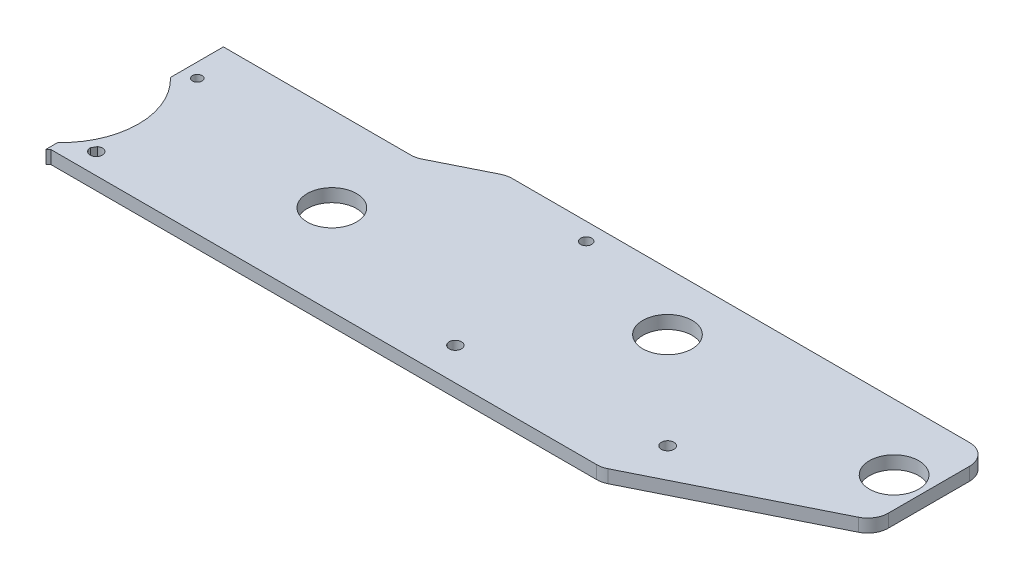
from build123d import *

# Parameters (mm, degrees)
SKETCH1_W           = 210
SKETCH1_H           = 50
SKETCH1_R           = 1.211665018
SKETCH1_R_2         = 1.165617118
SKETCH1_R_3         = 1.5
SKETCH1_R_4         = 1.517273905
SKETCH1_R_5         = 1.335614121
SKETCH1_R_6         = 1.62438417
BOSS_EXTRUDE1_DEPTH = 3.175
SKETCH2_R           = 2
CUT_EXTRUDE1_DEPTH  = 10
SKETCH3_R           = 6
SKETCH3_R_2         = 0.586995366
CUT_EXTRUDE2_DEPTH  = 57.15
CUT_EXTRUDE7_DEPTH  = 10
FILLET3_R           = 5
SKETCH11_R          = 18.5
SKETCH11_R_2        = 2
BOSS_EXTRUDE4_DEPTH = 3.175
SKETCH12_R          = 21
BOSS_EXTRUDE5_DEPTH = 3.175
SKETCH13_R          = 18.85
CUT_EXTRUDE8_DEPTH  = 3.175
BOSS_EXTRUDE6_DEPTH = 3.175
FILLET4_R           = 5
SKETCH15_R          = 1.5
CUT_EXTRUDE9_DEPTH  = 10
SKETCH16_R          = 1.5
CUT_EXTRUDE10_DEPTH = 10
SKETCH17_W          = 82.811100577
SKETCH17_H          = 66.522656387
CUT_EXTRUDE11_DEPTH = 10


with BuildPart() as part:
    # Sketch1 → Boss-Extrude1 (new body)
    with BuildSketch(Plane(origin=(0, 0, 0), x_dir=(1, 0, 0), z_dir=(0, 1, 0))):
        with Locations((105, -25)):
            Rectangle(SKETCH1_W, SKETCH1_H)
        with Locations(Location((3.489526233, -16.787661112, 0), (0, 0, 270))):
            Circle(SKETCH1_R, mode=Mode.SUBTRACT)
        with Locations(Location((34.37258772, -17.194005245, 0), (0, 0, 270))):
            Circle(SKETCH1_R_2, mode=Mode.SUBTRACT)
        with Locations(Location((37.520749958, -44.921198121, 0), (0, 0, 270))):
            Circle(SKETCH1_R_3, mode=Mode.SUBTRACT)
        with Locations(Location((168.975233936, -37.403209633, 0), (0, 0, 270))):
            Circle(SKETCH1_R_4, mode=Mode.SUBTRACT)
        with Locations(Location((116, -4.237214774, 0), (0, 0, 270))):
            Circle(SKETCH1_R_5, mode=Mode.SUBTRACT)
        with Locations(Location((12.257640281, -3.274812063, 0), (0, 0, 270))):
            Circle(SKETCH1_R_6, mode=Mode.SUBTRACT)
    extrude(amount=BOSS_EXTRUDE1_DEPTH)

    # Sketch2 → Cut-Extrude1 (cut)
    with BuildSketch(Plane(origin=(0, 3.175, 0), x_dir=(1, 0, 0), z_dir=(0, 1, 0))):
        with Locations(Location((10, -26, 0), (0, 0, 270))):
            Circle(SKETCH2_R)
        with Locations(Location((10, -42, 0), (0, 0, 270))):
            Circle(SKETCH2_R)
        with Locations(Location((26, -26, 0), (0, 0, 270))):
            Circle(SKETCH2_R)
        with Locations(Location((26, -42, 0), (0, 0, 270))):
            Circle(SKETCH2_R)
    extrude(amount=-CUT_EXTRUDE1_DEPTH, mode=Mode.SUBTRACT)

    # Sketch3 → Cut-Extrude2 (cut)
    with BuildSketch(Plane(origin=(0, 3.175, 0), x_dir=(1, 0, 0), z_dir=(0, 1, 0))):
        with Locations(Location((78.01026379, -28.1, 0), (0, 0, 270))):
            Circle(SKETCH3_R)
        with Locations(Location((145.531297368, -14, 0), (0, 0, 270))):
            Circle(SKETCH3_R)
        with Locations(Location((18, -34, 0), (0, 0, 270))):
            Circle(SKETCH3_R_2)
        with Locations(Location((202.646291021, -16, 0), (0, 0, 270))):
            Circle(SKETCH3_R)
    extrude(amount=-CUT_EXTRUDE2_DEPTH, mode=Mode.SUBTRACT)

    # Sketch10 → Cut-Extrude7 (cut)
    with BuildSketch(Plane(origin=(0, 3.175, 0), x_dir=(1, 0, 0), z_dir=(0, 1, 0))):
        Polygon((210, -27.859435908), (165.502877994, -50), (210, -50), align=None)
        Polygon((92.532613397, 0), (77.65477062, -7.402812063), (0, -7.402812063), (0, 0), align=None)
    extrude(amount=-CUT_EXTRUDE7_DEPTH, mode=Mode.SUBTRACT)

    # Fillet3
    fillet3_edges = [part.edges().sort_by_distance(p)[0] for p in [
        (210, 1.5875, 0),
        (0, 1.5875, 50),
        (92.532613397, 1.5875, 0),
        (210, 1.5875, 27.859435908),
        (165.502877994, 1.5875, 50),
        (77.65477062, 1.5875, 7.402812063),
        (0, 1.5875, 7.402812063),
    ]]
    fillet(fillet3_edges, radius=FILLET3_R)

    # Sketch11 → Boss-Extrude4 (add)
    with BuildSketch(Plane(origin=(0, 3.175, 0), x_dir=(1, 0, 0), z_dir=(0, 1, 0))):
        with Locations((18, -34)):
            Circle(SKETCH11_R)
        with Locations(Location((10, -26, 0), (0, 0, 270))):
            Circle(SKETCH11_R_2, mode=Mode.SUBTRACT)
        with Locations(Location((10, -42, 0), (0, 0, 270))):
            Circle(SKETCH11_R_2, mode=Mode.SUBTRACT)
        with Locations(Location((26, -26, 0), (0, 0, 270))):
            Circle(SKETCH11_R_2, mode=Mode.SUBTRACT)
        with Locations(Location((26, -42, 0), (0, 0, 270))):
            Circle(SKETCH11_R_2, mode=Mode.SUBTRACT)
    extrude(amount=-BOSS_EXTRUDE4_DEPTH)

    # Sketch12 → Boss-Extrude5 (add)
    with BuildSketch(Plane(origin=(0, 3.175, 0), x_dir=(1, 0, 0), z_dir=(0, 1, 0))):
        with Locations((18, -34)):
            Circle(SKETCH12_R)
    extrude(amount=-BOSS_EXTRUDE5_DEPTH)

    # Sketch13 → Cut-Extrude8 (cut)
    with BuildSketch(Plane(origin=(0, 3.175, 0), x_dir=(1, 0, 0), z_dir=(0, 1, 0))):
        with Locations(Location((18, -34, 0), (0, 0, 270))):
            Circle(SKETCH13_R)
    extrude(amount=-CUT_EXTRUDE8_DEPTH, mode=Mode.SUBTRACT)

    # Sketch14 → Boss-Extrude6 (add)
    with BuildSketch(Plane(origin=(0, 3.175, 0), x_dir=(1, 0, 0), z_dir=(0, 1, 0))):
        with BuildLine():
            Line((-35.83, -34.272812063), (-2.998227868, -34.272812063))
            ThreePointArc((-2.998227868, -34.272812063), (-2.272136238, -28.519079241), (0, -23.183346174))
            Line((0, -23.183346174), (0, -12.402812063))
            Line((0, -12.402812063), (0, -12.248529085))
            Line((0, -12.248529085), (0, 0.727187937))
            Line((0, 0.727187937), (-35.83, 0.727187937))
            Line((-35.83, 0.727187937), (-35.83, -34.272812063))
        make_face()
        with BuildLine():
            Line((0, 0.727187937), (0, -12.248529085))
            Line((0, -12.248529085), (0.002380891, -12.248529085))
            ThreePointArc((0.002380891, -12.248529085), (1.51944077, -8.813145304), (5, -7.402812063))
            Line((5, -7.402812063), (18, -7.402812063))
            Line((18, -7.402812063), (18, 0.727187937))
            Line((18, 0.727187937), (0, 0.727187937))
        make_face()
    extrude(amount=-BOSS_EXTRUDE6_DEPTH)

    # Fillet4
    fillet4_edges = [part.edges().sort_by_distance(p)[0] for p in [
        (-35.83, 1.5875, 34.272812063),
        (-35.83, 1.5875, -0.727187937),
        (18, 1.5875, -0.727187937),
    ]]
    fillet(fillet4_edges, radius=FILLET4_R)

    # Sketch15 → Cut-Extrude9 (cut)
    with BuildSketch(Plane(origin=(0, 3.175, 0), x_dir=(1, 0, 0), z_dir=(0, 1, 0))):
        with Locations(Location((122, -42.058139805, 0), (0, 0, 270))):
            Circle(SKETCH15_R)
    extrude(amount=-CUT_EXTRUDE9_DEPTH, mode=Mode.SUBTRACT)

    # Sketch16 → Cut-Extrude10 (cut)
    with BuildSketch(Plane(origin=(0, 3.175, 0), x_dir=(1, 0, 0), z_dir=(0, 1, 0))):
        with Locations(Location((12, -3.272812063, 0), (0, 0, 270))):
            Circle(SKETCH16_R)
    extrude(amount=-CUT_EXTRUDE10_DEPTH, mode=Mode.SUBTRACT)

    # Sketch17 → Cut-Extrude11 (cut)
    with BuildSketch(Plane(origin=(0, 3.175, 0), x_dir=(1, 0, 0), z_dir=(0, 1, 0))):
        with Locations((-10.47799366, -23.384449303)):
            Rectangle(SKETCH17_W, SKETCH17_H)
    extrude(amount=-CUT_EXTRUDE11_DEPTH, mode=Mode.SUBTRACT)


solid = part.part
